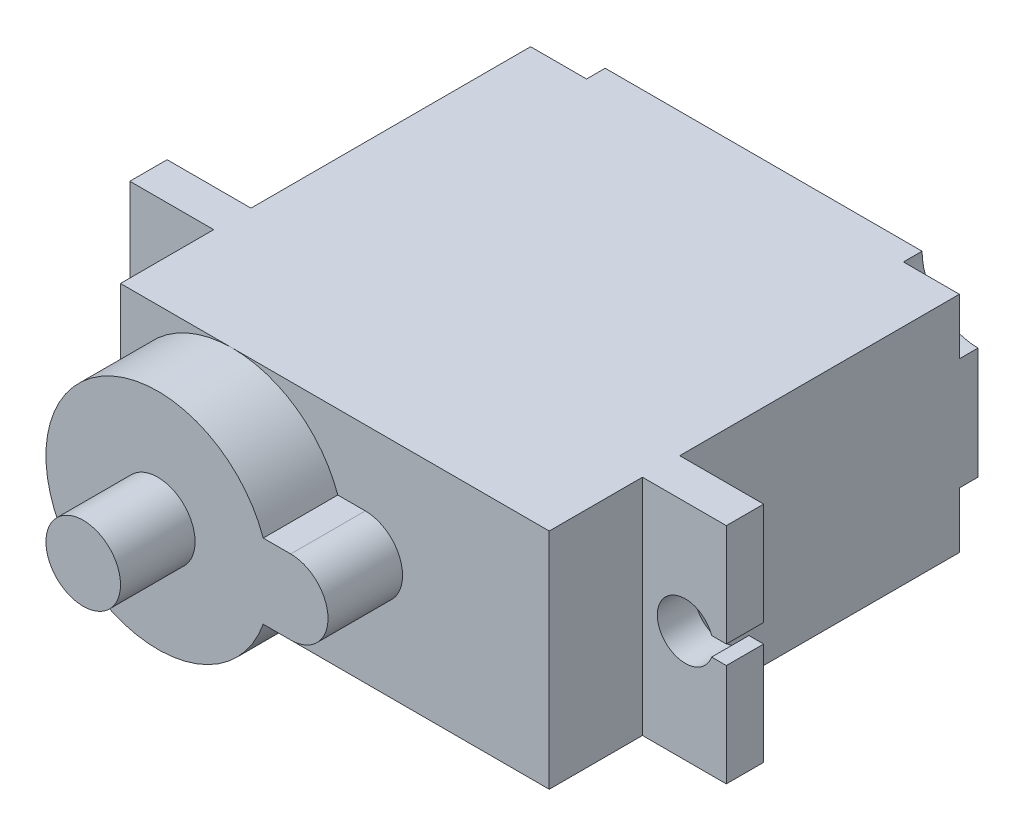
from build123d import *

# Parameters (mm, degrees)
SKETCH_1_W               = 23
SKETCH_1_H               = 12
EXTRUDE_1_DEPTH          = 16
SKETCH_2_W               = 32
SKETCH_2_H               = 12
EXTRUDE_2_DEPTH          = 2
SKETCH_3_W               = 23
SKETCH_3_H               = 12
EXTRUDE_3_DEPTH          = 5
EXTRUDE_4_DEPTH          = 4
SKETCH_6_R               = 2
EXTRUDE_5_DEPTH          = 4
CUT_EXTRUDE_1_DEPTH      = 4
SKETCH_9_R               = 3
CUT_EXTRUDE_2_DEPTH      = 1
MIRROR_3_COPY_1_SKETCH_R = 3
MIRROR_3_COPY_1_DEPTH    = 1


with BuildPart() as part:
    # 草图1 → 凸台-拉伸1 (new body)
    with BuildSketch(Plane.XY):
        Rectangle(SKETCH_1_W, SKETCH_1_H)
    extrude(amount=EXTRUDE_1_DEPTH)

    # 草图2 → 凸台-拉伸2 (add)
    with BuildSketch(Plane.XY.offset(16)):
        Rectangle(SKETCH_2_W, SKETCH_2_H)
    extrude(amount=EXTRUDE_2_DEPTH)

    # 草图3 → 凸台-拉伸3 (add)
    with BuildSketch(Plane.XY.offset(18)):
        Rectangle(SKETCH_3_W, SKETCH_3_H)
    extrude(amount=EXTRUDE_3_DEPTH)

    # 草图4 → 凸台-拉伸4 (add)
    with BuildSketch(Plane.XY.offset(23)):
        with BuildLine():
            Line((1.631262932, 2), (0.156854249, 2))
            ThreePointArc((0.156854249, 2), (-11.5, 0), (0.156854249, -2))
            Line((0.156854249, -2), (1.631262932, -2))
            ThreePointArc((1.631262932, -2), (3.631262932, 0), (1.631262932, 2))
        make_face()
    extrude(amount=EXTRUDE_4_DEPTH)

    # 草图6 → 凸台-拉伸5 (add)
    with BuildSketch(Plane.XY.offset(27)):
        with Locations((-5.5, 0)):
            Circle(SKETCH_6_R)
    extrude(amount=EXTRUDE_5_DEPTH)

    # 草图8 → 切除-拉伸1 (cut)
    with BuildSketch(Plane.XY.offset(18)):
        with BuildLine():
            Line((15.211851697, 0.5), (16, 0.5))
            Line((16, 0.5), (16, -0.5))
            Line((16, -0.5), (15.211851697, -0.5))
            ThreePointArc((15.211851697, -0.5), (12.297638134, 0), (15.211851697, 0.5))
        make_face()
    cut_extrude_1 = extrude(amount=-CUT_EXTRUDE_1_DEPTH, mode=Mode.SUBTRACT)

    # 镜向1: 切除-拉伸1 across plane
    add(cut_extrude_1.mirror(Plane(origin=(0, 0, 0), x_dir=(0, 0, 1), z_dir=(1, 0, 0))), mode=Mode.SUBTRACT)

    # 草图9 → 切除-拉伸2 (cut)
    with BuildSketch(Plane(origin=(0, 0, 0), x_dir=(-1, 0, 0), z_dir=(0, 0, -1))):
        with Locations((11.5, 6)):
            Circle(SKETCH_9_R)
    cut_extrude_2 = extrude(amount=-CUT_EXTRUDE_2_DEPTH, mode=Mode.SUBTRACT)

    # 镜向2: 切除-拉伸2 across plane
    add(cut_extrude_2.mirror(Plane(origin=(0, 0, 0), x_dir=(0, 0, 1), z_dir=(1, 0, 0))), mode=Mode.SUBTRACT)

    # 镜向3: 切除-拉伸2 across plane
    add(cut_extrude_2.mirror(Plane.ZX), mode=Mode.SUBTRACT)

    # 镜向3 copy 1 sketch → 镜向3 copy 1 (cut)
    with BuildSketch(Plane(origin=(0, 0, 0), x_dir=(1, 0, 0), z_dir=(0, 0, -1))):
        with Locations((11.5, 6)):
            Circle(MIRROR_3_COPY_1_SKETCH_R)
    extrude(amount=-MIRROR_3_COPY_1_DEPTH, mode=Mode.SUBTRACT)


solid = part.part
